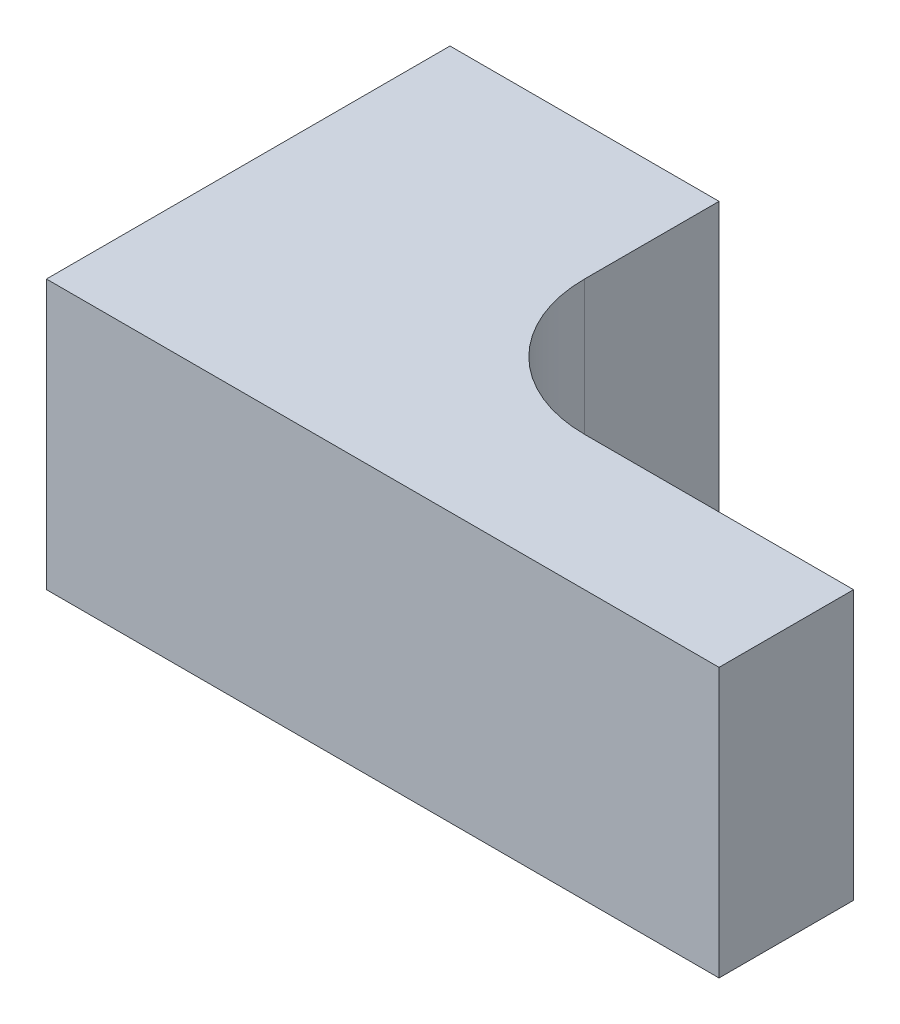
from build123d import *

# Parameters (mm, degrees)
BOSS_EXTRUDE1_DEPTH = 20


with BuildPart() as part:
    # Sketch2 → Boss-Extrude1 (new body)
    with BuildSketch(Plane(origin=(0, 0, 0), x_dir=(1, 0, 0), z_dir=(0, 1, 0))):
        with BuildLine():
            Line((0, 0), (0, -10))
            ThreePointArc((0, -10), (2.928932188, -17.071067812), (10, -20))
            Line((10, -20), (30, -20))
            Line((30, -20), (30, -30))
            Line((30, -30), (-20, -30))
            Line((-20, -30), (-20, 0))
            Line((-20, 0), (0, 0))
        make_face()
    extrude(amount=BOSS_EXTRUDE1_DEPTH)


solid = part.part
